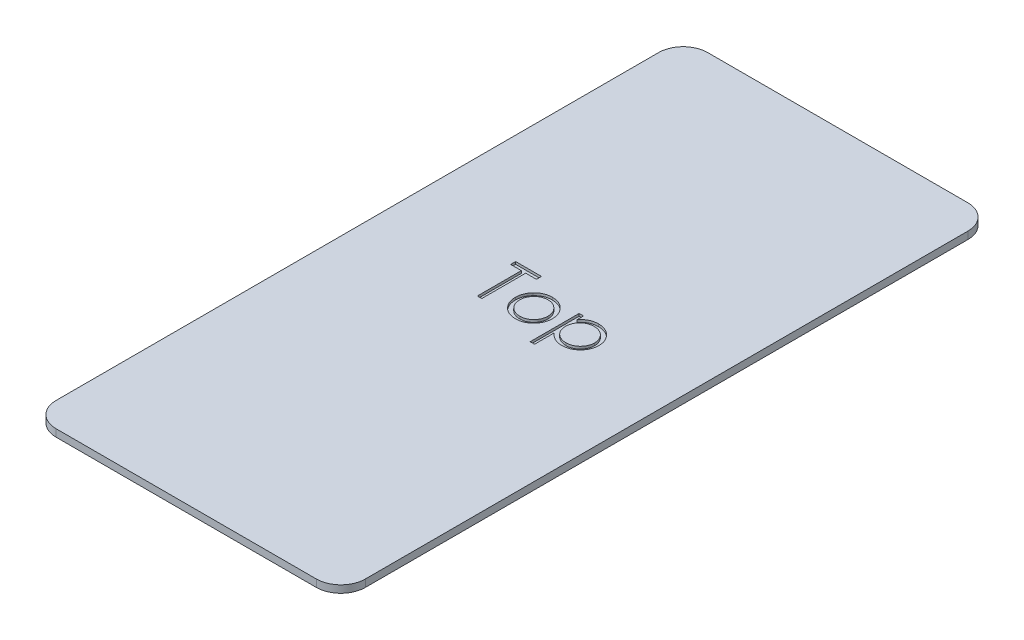
from build123d import *

# Parameters (mm, degrees)
SKETCH1_W           = 126.21
SKETCH1_H           = 265.91
BOSS_EXTRUDE1_DEPTH = 3
CUT_EXTRUDE1_DEPTH  = 1
FILLET1_R           = 10


with BuildPart() as part:
    # Sketch1 → Boss-Extrude1 (new body)
    with BuildSketch(Plane(origin=(0, 0, 0), x_dir=(1, 0, 0), z_dir=(0, 1, 0))):
        Rectangle(SKETCH1_W, SKETCH1_H)
    extrude(amount=BOSS_EXTRUDE1_DEPTH)

    # Sketch2 → Cut-Extrude1 (cut)
    # profile 1 of 3: a face of its own
    with BuildSketch(Plane(origin=(0, 3, 0), x_dir=(1, 0, 0), z_dir=(0, 1, 0))):
        Polygon((-18.407097088, 17.862708941), (-18.407097088, 19.913990992), (-7.894276575, 19.913990992), (-7.894276575, 17.862708941), (-12.253250934, 17.862708941), (-12.253250934, -0.086009008), (-14.048122729, -0.086009008), (-14.048122729, 17.862708941), align=None)
    # profile 2 of 3: a face of its own
    with BuildSketch(Plane(origin=(0, 3, 0), x_dir=(1, 0, 0), z_dir=(0, 1, 0))):
        with BuildLine():
            add(Edge.make_bspline(
                [(1.72912086, 14.785785864), (2.003356705, 14.779946486), (2.541066177, 14.768496893), (3.328539811, 14.646125661), (4.080226302, 14.458997864), (4.799004543, 14.200303224), (5.475669088, 13.853549221), (6.120076197, 13.439781843), (6.730459105, 12.949595594), (7.096304987, 12.570406632), (7.282005476, 12.3779333)],
                knots=[0, 0, 0, 0, 1.054011418, 2.066658804, 3.057071809, 4.030435133, 4.997543892, 5.974964718, 6.972108034, 8, 8, 8, 8], degree=3))
            add(Edge.make_bspline(
                [(7.282005476, 12.3779333), (7.441902356, 12.193853381), (7.758601672, 11.829255997), (8.164691494, 11.238081066), (8.51452898, 10.62585192), (8.794888757, 9.984438624), (9.015946035, 9.319440503), (9.172892871, 8.628571868), (9.266246785, 7.913358456), (9.278835168, 7.427622238), (9.285210604, 7.181619197)],
                knots=[0, 0, 0, 0, 1.025258237, 2.030674902, 3.01204498, 3.988269485, 4.97094183, 5.956517959, 6.965070386, 8, 8, 8, 8], degree=3))
            add(Edge.make_bspline(
                [(9.285210604, 7.181619197), (9.279602962, 6.934190296), (9.268522001, 6.445259249), (9.163701335, 5.725148587), (9.000666559, 5.026892458), (8.767341769, 4.353414207), (8.468152574, 3.702655194), (8.103062931, 3.077457769), (7.669510833, 2.476588436), (7.178059422, 1.90514936), (6.634905844, 1.378485276), (6.045670711, 0.919466593), (5.421933376, 0.526200739), (4.755399928, 0.209421221), (4.052157146, -0.040348495), (3.310688186, -0.21577716), (2.532144927, -0.321843924), (2.000560805, -0.335464343), (1.72912086, -0.342419264)],
                knots=[0, 0, 0, 0, 0.998656419, 1.973391657, 2.932242238, 3.890759089, 4.846373663, 5.82037756, 6.809684879, 7.83454468, 8.860553229, 9.859544525, 10.845671541, 11.83227036, 12.833544569, 13.85385346, 14.904124723, 16, 16, 16, 16], degree=3))
            add(Edge.make_bspline(
                [(1.72912086, -0.342419264), (1.456351035, -0.335441), (0.922117551, -0.321773717), (0.140826225, -0.216189245), (-0.601971597, -0.040429344), (-1.306135017, 0.210242043), (-1.975534143, 0.526210864), (-2.602885554, 0.918277662), (-3.192599357, 1.378621406), (-3.735867839, 1.905112475), (-4.227288441, 2.47659794), (-4.660848489, 3.077455303), (-5.025936067, 3.702655836), (-5.325125803, 4.353414036), (-5.558450449, 5.026892503), (-5.721485264, 5.725148575), (-5.826305918, 6.445259252), (-5.837386882, 6.934190297), (-5.842994524, 7.181619197)],
                knots=[0, 0, 0, 0, 1.099876186, 2.154163076, 3.173186993, 4.173200201, 5.163417411, 6.152872554, 7.150605724, 8.17532212, 9.198891216, 10.186952605, 11.159729845, 12.11414092, 13.071450619, 14.029093627, 15.002601286, 16, 16, 16, 16], degree=3))
            add(Edge.make_bspline(
                [(-5.842994524, 7.181619197), (-5.836575608, 7.426285174), (-5.823867257, 7.910681759), (-5.730607205, 8.624550677), (-5.574272596, 9.314250043), (-5.352950331, 9.976681335), (-5.070006383, 10.615283826), (-4.725084738, 11.229025718), (-4.314852552, 11.817527435), (-3.999412829, 12.181653606), (-3.839789396, 12.365914069)],
                knots=[0, 0, 0, 0, 1.031353054, 2.041901799, 3.029428768, 4.008703097, 4.981709435, 5.96992636, 6.972712378, 8, 8, 8, 8], degree=3))
            add(Edge.make_bspline(
                [(-3.839789396, 12.365914069), (-3.654368876, 12.560056579), (-3.289706797, 12.941871986), (-2.676285495, 13.430629267), (-2.03346366, 13.853006832), (-1.349321225, 14.19287092), (-0.631133466, 14.460519593), (0.124405063, 14.64660825), (0.914550866, 14.768055993), (1.454891558, 14.779817009), (1.72912086, 14.785785864)],
                knots=[0, 0, 0, 0, 1.027980169, 2.021703884, 2.998553061, 3.971491411, 4.943284454, 5.930300938, 6.949603206, 8, 8, 8, 8], degree=3))
        make_face()
        with BuildLine():
            add(Edge.make_bspline(
                [(1.72110804, 12.990914069), (1.527178832, 12.985402117), (1.144326669, 12.974520502), (0.580786185, 12.891755332), (0.038271019, 12.760626738), (-0.48424809, 12.574317845), (-0.985009075, 12.333752708), (-1.464491375, 12.038276364), (-1.924105317, 11.691802327), (-2.354859965, 11.294872775), (-2.750187463, 10.86127852), (-3.095775901, 10.399287898), (-3.389633651, 9.916394491), (-3.63443456, 9.412096142), (-3.816761349, 8.881282348), (-3.94917862, 8.329964455), (-4.031865708, 7.757019218), (-4.042645015, 7.367527685), (-4.048122729, 7.169599967)],
                knots=[0, 0, 0, 0, 1.021534396, 2.016698045, 2.994645724, 3.958388632, 4.93408049, 5.916473867, 6.921342795, 7.962252576, 8.998418191, 10.008913653, 10.997312074, 11.973003931, 12.956656626, 13.948281152, 14.957379055, 16, 16, 16, 16], degree=3))
            add(Edge.make_bspline(
                [(-4.048122729, 7.169599967), (-4.03894088, 6.913874097), (-4.020716626, 6.406306066), (-3.872515275, 5.658813936), (-3.624593676, 4.941203353), (-3.28980922, 4.257681147), (-2.870345113, 3.625268129), (-2.376133304, 3.061431076), (-1.812477873, 2.57465501), (-1.186097872, 2.170764464), (-0.509787484, 1.849851575), (0.205962922, 1.622428856), (0.952481174, 1.474590614), (1.462656781, 1.459896475), (1.72110804, 1.452452531)],
                knots=[0, 0, 0, 0, 1.016792936, 2.018143844, 3.017858371, 4.030088057, 5.03801393, 6.028138512, 7.003788237, 7.991172063, 8.984598303, 9.972568034, 10.972917682, 12, 12, 12, 12], degree=3))
            add(Edge.make_bspline(
                [(1.72110804, 1.452452531), (1.979544434, 1.459939846), (2.489690697, 1.4747196), (3.235171707, 1.621684284), (3.948965832, 1.85084806), (4.624573761, 2.170403545), (5.250668637, 2.576188772), (5.818377902, 3.058682355), (6.308369966, 3.626761506), (6.727419137, 4.258518813), (7.067686238, 4.940143682), (7.314447391, 5.658946381), (7.463005025, 6.406272335), (7.481181189, 6.913862796), (7.490338809, 7.169599967)],
                knots=[0, 0, 0, 0, 1.02726834, 2.027799167, 3.010890988, 4.004497153, 4.992059811, 5.971914811, 6.958719428, 7.966827853, 8.981595046, 9.981490638, 10.983022906, 12, 12, 12, 12], degree=3))
            add(Edge.make_bspline(
                [(7.490338809, 7.169599967), (7.48486298, 7.367528868), (7.474087386, 7.757022729), (7.391373303, 8.329951035), (7.259055934, 8.881331587), (7.076360978, 9.411914463), (6.832623756, 9.917700202), (6.533099224, 10.397870071), (6.188921936, 10.862878905), (5.788824103, 11.293471139), (5.358519086, 11.691957062), (4.898718868, 12.038410716), (4.419947562, 12.332454118), (3.920641375, 12.576375493), (3.398055274, 12.758931724), (2.85630025, 12.892512475), (2.295164194, 12.974170741), (1.913683947, 12.985297264), (1.72110804, 12.990914069)],
                knots=[0, 0, 0, 0, 1.042956736, 2.052379634, 3.044323526, 4.02829302, 5.004299113, 5.996692471, 7.007513377, 8.048758398, 9.090003419, 10.095195979, 11.07790575, 12.047570684, 13.018257071, 13.989683339, 14.985167495, 16, 16, 16, 16], degree=3))
        make_face(mode=Mode.SUBTRACT)
    # profile 3 of 3: a face of its own
    with BuildSketch(Plane(origin=(0, 3, 0), x_dir=(1, 0, 0), z_dir=(0, 1, 0))):
        with BuildLine():
            Line((12.874954194, 14.529375608), (14.669825989, 14.529375608))
            Line((14.669825989, 14.529375608), (14.669825989, 11.825048685))
            add(Edge.make_bspline(
                [(14.669825989, 11.825048685), (14.860440183, 12.070407163), (15.230860724, 12.547212266), (15.869288752, 13.164298715), (16.543156232, 13.684729021), (17.269804303, 14.09262921), (18.037939675, 14.400176707), (18.84441006, 14.627487849), (19.696060145, 14.761439132), (20.278325589, 14.77756291), (20.575274707, 14.785785864)],
                knots=[0, 0, 0, 0, 1.0828784, 2.104357462, 3.088488658, 4.04616522, 5.001424249, 5.969181776, 6.964304535, 8, 8, 8, 8], degree=3))
            add(Edge.make_bspline(
                [(20.575274707, 14.785785864), (20.834655296, 14.778281985), (21.347334658, 14.763450173), (22.10198168, 14.663032718), (22.828698158, 14.490931619), (23.523372752, 14.242926388), (24.19344741, 13.936323703), (24.829002266, 13.549369214), (25.43993687, 13.101333838), (26.010886522, 12.585721547), (26.538437194, 12.027845739), (26.994701086, 11.427718287), (27.388254825, 10.805074936), (27.706370804, 10.15026298), (27.955561361, 9.46843881), (28.13278809, 8.756847719), (28.238260339, 8.018128059), (28.252411491, 7.515826799), (28.259569578, 7.261747402)],
                knots=[0, 0, 0, 0, 1.041296284, 2.058176809, 3.050446431, 4.034000596, 5.01514041, 6.003636468, 7.015969324, 8.052561599, 9.08815499, 10.094063707, 11.074456064, 12.040834395, 13.011057502, 13.983766392, 14.980127149, 16, 16, 16, 16], degree=3))
            add(Edge.make_bspline(
                [(28.259569578, 7.261747402), (28.252566804, 7.002305639), (28.238756322, 6.490649042), (28.131642002, 5.739294201), (27.960459864, 5.016509208), (27.714413103, 4.323496273), (27.396461741, 3.660732551), (27.009578539, 3.028696002), (26.553084442, 2.427589127), (26.031363712, 1.865572555), (25.465346934, 1.347862196), (24.860332709, 0.895073227), (24.225710277, 0.514836796), (23.564726465, 0.197219885), (22.871722816, -0.042164024), (22.149932658, -0.214837171), (21.399748964, -0.321320004), (20.889456666, -0.335332246), (20.63136445, -0.342419264)],
                knots=[0, 0, 0, 0, 1.038740735, 2.04854663, 3.033179607, 4.009277356, 4.987731542, 5.972001279, 6.972200261, 8.005528982, 9.039189865, 10.040446548, 11.026516639, 11.997840187, 12.972163198, 13.956796175, 14.96660207, 16, 16, 16, 16], degree=3))
            add(Edge.make_bspline(
                [(20.63136445, -0.342419264), (20.340921182, -0.335020363), (19.767210576, -0.320405364), (18.928366745, -0.172294449), (18.121070448, 0.049059469), (17.354265736, 0.373053718), (16.621878235, 0.78594238), (15.928050774, 1.289429271), (15.2690979, 1.882461413), (14.87247643, 2.332357505), (14.669825989, 2.562228172)],
                knots=[0, 0, 0, 0, 1.014726462, 2.004382257, 2.969841629, 3.936926163, 4.907207904, 5.903978561, 6.929055279, 8, 8, 8, 8], degree=3))
            Line((14.669825989, 2.562228172), (14.669825989, -5.470624392))
            Line((14.669825989, -5.470624392), (12.874954194, -5.470624392))
            Line((12.874954194, -5.470624392), (12.874954194, 14.529375608))
        make_face()
        with BuildLine():
            add(Edge.make_bspline(
                [(20.559249066, 12.990914069), (20.35593728, 12.987255451), (19.955668778, 12.980052574), (19.368970384, 12.894487153), (18.803853654, 12.770271489), (18.266013932, 12.582203487), (17.750296123, 12.351353126), (17.260672325, 12.062884491), (16.797486224, 11.722015886), (16.361903194, 11.335276778), (15.96839866, 10.909135703), (15.620039071, 10.454348222), (15.327425899, 9.971490282), (15.084557212, 9.465059639), (14.899738454, 8.931086581), (14.768562912, 8.372612223), (14.686103753, 7.789025294), (14.675309826, 7.3915624), (14.669825989, 7.189632018)],
                knots=[0, 0, 0, 0, 1.05670511, 2.080379991, 3.077984906, 4.06214886, 5.038337365, 6.01289324, 7.01187578, 8.025460281, 9.038092164, 10.024533457, 11.000252242, 11.969694649, 12.940728589, 13.933144304, 14.949937299, 16, 16, 16, 16], degree=3))
            add(Edge.make_bspline(
                [(14.669825989, 7.189632018), (14.678916595, 6.924557089), (14.696725863, 6.405252854), (14.841510822, 5.646486443), (15.077140903, 4.928476983), (15.411590695, 4.257271057), (15.834148262, 3.640226285), (16.343280585, 3.087708533), (16.934380876, 2.60319087), (17.597621972, 2.195069421), (18.308605575, 1.863709042), (19.050239359, 1.626484982), (19.812324392, 1.480357963), (20.327571934, 1.461804711), (20.587293937, 1.452452531)],
                knots=[0, 0, 0, 0, 1.03728447, 2.032128127, 3.01272805, 3.987917167, 4.958271349, 5.931593992, 6.91984656, 7.941419022, 8.973179163, 9.983609215, 10.983593296, 12, 12, 12, 12], degree=3))
            add(Edge.make_bspline(
                [(20.587293937, 1.452452531), (20.84178404, 1.461346113), (21.346901143, 1.478998275), (22.090661837, 1.631787918), (22.813465485, 1.865188058), (23.500209328, 2.205528381), (24.144914972, 2.622614427), (24.727095278, 3.122957473), (25.235706213, 3.702900006), (25.669216813, 4.34866288), (26.018539586, 5.041093643), (26.2809981, 5.757558721), (26.432475661, 6.495532567), (26.453943025, 6.992662355), (26.464697784, 7.241715351)],
                knots=[0, 0, 0, 0, 1.00104056, 1.986885549, 2.97790532, 3.984399681, 4.995088187, 5.994304198, 6.996462723, 8.023150851, 9.048424203, 10.043036403, 11.019596776, 12, 12, 12, 12], degree=3))
            add(Edge.make_bspline(
                [(26.464697784, 7.241715351), (26.456385019, 7.492315289), (26.439824254, 7.991562739), (26.276698324, 8.727350756), (26.031555595, 9.446710619), (25.674075298, 10.129685189), (25.250068044, 10.774108518), (24.737228061, 11.342987827), (24.162278367, 11.841105957), (23.518340287, 12.252622585), (22.827252142, 12.57996827), (22.099738337, 12.81930335), (21.33948918, 12.963153346), (20.821616869, 12.981579097), (20.559249066, 12.990914069)],
                knots=[0, 0, 0, 0, 0.983928682, 1.960191568, 2.949917689, 3.96440592, 4.982380491, 5.975291189, 6.965713506, 7.964880129, 8.970154049, 9.96478489, 10.968906225, 12, 12, 12, 12], degree=3))
        make_face(mode=Mode.SUBTRACT)
    extrude(amount=-CUT_EXTRUDE1_DEPTH, mode=Mode.SUBTRACT)

    # Fillet1
    fillet1_edges = [part.edges().sort_by_distance(p)[0] for p in [
        (63.105, 1.5, 132.955),
        (-63.105, 1.5, 132.955),
        (-63.105, 1.5, -132.955),
        (63.105, 1.5, -132.955),
    ]]
    fillet(fillet1_edges, radius=FILLET1_R)


solid = part.part
